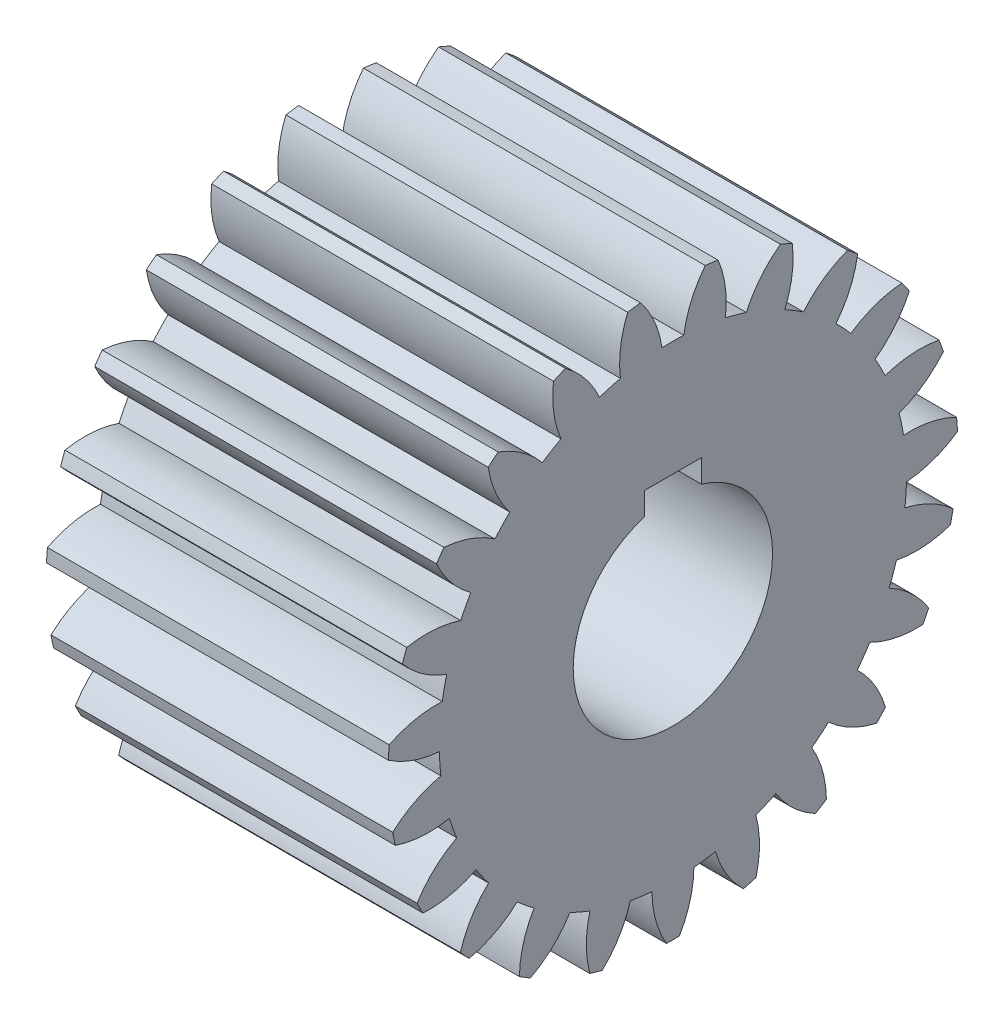
from build123d import *

# Parameters (mm, degrees)
BASPROSKE_W     = 60
BASPROSKE_H     = 50
TOOTHCUT_DEPTH  = 93.736184955
TEETHCUTS_COUNT = 23
TEETHCUTS_ANGLE = 344.347826087
BORSKE_R        = 17.5
BORE_DEPTH      = 60.0000508
KEYSKE_W        = 10
KEYSKE_H        = 20.8
KEYWAY_DEPTH    = 60.0000508


with BuildPart() as part:
    # BasProSke → Base-Revolve (revolve)
    with BuildSketch(Plane(origin=(0, 0, 0), x_dir=(1, 0, 0), z_dir=(0, 1, 0)), mode=Mode.PRIVATE) as base_revolve_sk:
        with Locations((30, 25)):
            Rectangle(BASPROSKE_W, BASPROSKE_H)
    revolve(base_revolve_sk.sketch.rotate(Axis((-10, 0, 0), (1, 0, 0)), 180), axis=Axis((-10, 0, 0), (1, 0, 0)))

    # TooCutSke → ToothCut (cut, through all)
    with BuildSketch(Plane(origin=(0, 0, 0), x_dir=(0, 0, -1), z_dir=(1, 0, 0))):
        with BuildLine():
            ThreePointArc((1.90971626, 40.954498957), (0, 40.999), (-1.90971626, 40.954498957))
            ThreePointArc((-1.90971626, 40.954498957), (-3.228022445, 45.57670564), (-5.698439072, 49.699783071))
            ThreePointArc((-5.698439072, 49.699783071), (0, 50.0254), (5.698439072, 49.699783071))
            ThreePointArc((5.698439072, 49.699783071), (3.228022445, 45.57670564), (1.90971626, 40.954498957))
        make_face()
    toothcut = extrude(amount=TOOTHCUT_DEPTH, mode=Mode.SUBTRACT)

    # TeethCuts: ToothCut ×23 about axis
    teethcuts_axis = Axis((-10, 0, 0), (1, 0, 0))
    for i in range(1, TEETHCUTS_COUNT):
        add(toothcut.rotate(teethcuts_axis, i * TEETHCUTS_ANGLE / (TEETHCUTS_COUNT - 1)), mode=Mode.SUBTRACT)

    # BorSke → Bore (cut, symmetric)
    with BuildSketch(Plane(origin=(0, 0, 0), x_dir=(0, 0, -1), z_dir=(1, 0, 0))):
        with Locations(Location((0, 0, 0), (0, 0, 180))):
            Circle(BORSKE_R)
    extrude(amount=BORE_DEPTH, both=True, mode=Mode.SUBTRACT)

    # KeySke → Keyway (cut, symmetric)
    with BuildSketch(Plane(origin=(0, 0, 0), x_dir=(0, 0, -1), z_dir=(1, 0, 0))):
        with Locations((0, 10.4)):
            Rectangle(KEYSKE_W, KEYSKE_H)
    extrude(amount=KEYWAY_DEPTH, both=True, mode=Mode.SUBTRACT)


solid = part.part
